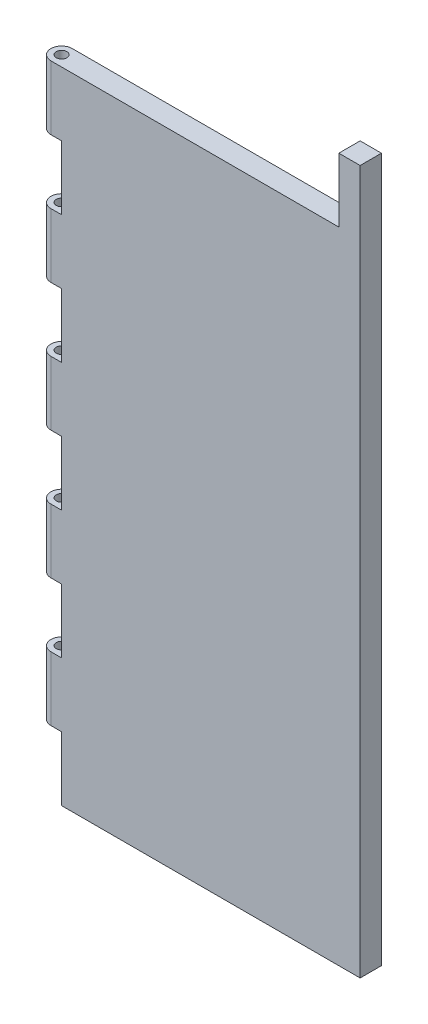
from build123d import *

# Parameters (mm, degrees)
BOSS_EXTRUDE1_DEPTH = 10
SKETCH2_W           = 10
SKETCH2_H           = 30
CUT_EXTRUDE1_DEPTH  = 363.629287289
SKETCH3_R           = 2.5
CUT_EXTRUDE2_DEPTH  = 336.559234711
FILLET3_RADIUS      = 5
FILLET3_LENGTH      = 30
FILLET4_RADIUS      = 5
FILLET4_LENGTH      = 30
FILLET5_RADIUS      = 5
FILLET5_LENGTH      = 30
FILLET6_RADIUS      = 5
FILLET6_LENGTH      = 30
FILLET7_RADIUS      = 5
FILLET7_LENGTH      = 30


with BuildPart() as part:
    # Sketch1 → Boss-Extrude1 (new body)
    with BuildSketch(Plane.XY):
        Polygon((0, 0), (150, 0), (150, 206.30867798), (150, 330), (140, 330), (140, 300), (0, 300), align=None)
    extrude(amount=BOSS_EXTRUDE1_DEPTH)

    # Sketch2 → Cut-Extrude1 (cut, through all)
    with BuildSketch(Plane.XY.offset(10)):
        with Locations((5, 75)):
            Rectangle(SKETCH2_W, SKETCH2_H)
        with Locations((5, 15)):
            Rectangle(SKETCH2_W, SKETCH2_H)
        with Locations((5, 135)):
            Rectangle(SKETCH2_W, SKETCH2_H)
        with Locations((5, 195)):
            Rectangle(SKETCH2_W, SKETCH2_H)
        with Locations((5, 255)):
            Rectangle(SKETCH2_W, SKETCH2_H)
    extrude(amount=-CUT_EXTRUDE1_DEPTH, mode=Mode.SUBTRACT)

    # Sketch3 → Cut-Extrude2 (cut, through all)
    with BuildSketch(Plane(origin=(0, 300, 0), x_dir=(1, 0, 0), z_dir=(0, 1, 0))):
        with Locations(Location((5, -5, 0), (0, 0, 270))):
            Circle(SKETCH3_R)
    extrude(amount=-CUT_EXTRUDE2_DEPTH, mode=Mode.SUBTRACT)

    # Fillet3: full round fillet: the end face becomes a half cylinder, R = half its width
    fillet3_face = Plane((0, 285, 5), x_dir=(0, -1, 0), z_dir=(-1, 0, 0))  # on the end face: x along it, z out of the body
    fillet3_slab = fillet3_face.offset(-FILLET3_RADIUS / 2) * Box(FILLET3_LENGTH, 2 * FILLET3_RADIUS, FILLET3_RADIUS, mode=Mode.PRIVATE)  # the body's end, R deep
    fillet3_round = Plane((5, 285, 5), x_dir=(-1, 0, 0), z_dir=(0, -1, 0)) * Cylinder(FILLET3_RADIUS, FILLET3_LENGTH, mode=Mode.PRIVATE)  # its axis R under the face
    add(fillet3_slab - fillet3_round, mode=Mode.SUBTRACT)

    # Fillet4: full round fillet: the end face becomes a half cylinder, R = half its width
    fillet4_face = Plane((0, 225, 5), x_dir=(0, -1, 0), z_dir=(-1, 0, 0))  # on the end face: x along it, z out of the body
    fillet4_slab = fillet4_face.offset(-FILLET4_RADIUS / 2) * Box(FILLET4_LENGTH, 2 * FILLET4_RADIUS, FILLET4_RADIUS, mode=Mode.PRIVATE)  # the body's end, R deep
    fillet4_round = Plane((5, 225, 5), x_dir=(-1, 0, 0), z_dir=(0, -1, 0)) * Cylinder(FILLET4_RADIUS, FILLET4_LENGTH, mode=Mode.PRIVATE)  # its axis R under the face
    add(fillet4_slab - fillet4_round, mode=Mode.SUBTRACT)

    # Fillet5: full round fillet: the end face becomes a half cylinder, R = half its width
    fillet5_face = Plane((0, 165, 5), x_dir=(0, -1, 0), z_dir=(-1, 0, 0))  # on the end face: x along it, z out of the body
    fillet5_slab = fillet5_face.offset(-FILLET5_RADIUS / 2) * Box(FILLET5_LENGTH, 2 * FILLET5_RADIUS, FILLET5_RADIUS, mode=Mode.PRIVATE)  # the body's end, R deep
    fillet5_round = Plane((5, 165, 5), x_dir=(-1, 0, 0), z_dir=(0, -1, 0)) * Cylinder(FILLET5_RADIUS, FILLET5_LENGTH, mode=Mode.PRIVATE)  # its axis R under the face
    add(fillet5_slab - fillet5_round, mode=Mode.SUBTRACT)

    # Fillet6: full round fillet: the end face becomes a half cylinder, R = half its width
    fillet6_face = Plane((0, 105, 5), x_dir=(0, -1, 0), z_dir=(-1, 0, 0))  # on the end face: x along it, z out of the body
    fillet6_slab = fillet6_face.offset(-FILLET6_RADIUS / 2) * Box(FILLET6_LENGTH, 2 * FILLET6_RADIUS, FILLET6_RADIUS, mode=Mode.PRIVATE)  # the body's end, R deep
    fillet6_round = Plane((5, 105, 5), x_dir=(-1, 0, 0), z_dir=(0, -1, 0)) * Cylinder(FILLET6_RADIUS, FILLET6_LENGTH, mode=Mode.PRIVATE)  # its axis R under the face
    add(fillet6_slab - fillet6_round, mode=Mode.SUBTRACT)

    # Fillet7: full round fillet: the end face becomes a half cylinder, R = half its width
    fillet7_face = Plane((0, 45, 5), x_dir=(0, -1, 0), z_dir=(-1, 0, 0))  # on the end face: x along it, z out of the body
    fillet7_slab = fillet7_face.offset(-FILLET7_RADIUS / 2) * Box(FILLET7_LENGTH, 2 * FILLET7_RADIUS, FILLET7_RADIUS, mode=Mode.PRIVATE)  # the body's end, R deep
    fillet7_round = Plane((5, 45, 5), x_dir=(-1, 0, 0), z_dir=(0, -1, 0)) * Cylinder(FILLET7_RADIUS, FILLET7_LENGTH, mode=Mode.PRIVATE)  # its axis R under the face
    add(fillet7_slab - fillet7_round, mode=Mode.SUBTRACT)


solid = part.part
